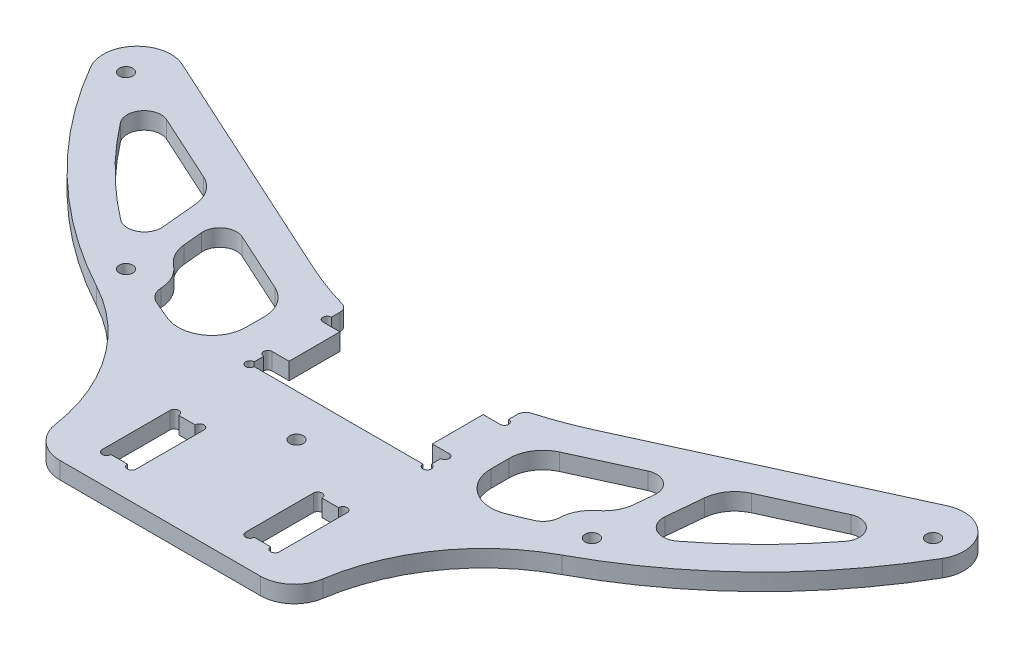
from build123d import *

# Parameters (mm, degrees)
BOSS_EXTRUDE1_DEPTH    = 6.35
FILLET4_R              = 3.175
F_10_CLEARANCE_HOLE1_D = 5.1054
CUT_EXTRUDE1_DEPTH     = 278.292988553
FILLET5_R              = 12.7
SKETCH5_R              = 1.5875
CUT_EXTRUDE2_DEPTH     = 278.292988553
CUT_EXTRUDE3_DEPTH     = 278.292988553


with BuildPart() as part:
    # Sketch1 → Boss-Extrude1 (new body)
    with BuildSketch(Plane(origin=(0, 0, 0), x_dir=(1, 0, 0), z_dir=(0, 1, 0))):
        with BuildLine():
            Line((33.17875, -158.75), (33.17875, -153.648789236))
            ThreePointArc((33.17875, -153.648789236), (34.76625, -152.061289236), (33.17875, -150.473789236))
            Line((33.17875, -150.473789236), (26.82875, -150.473789236))
            Line((26.82875, -150.473789236), (26.82875, -131.423789236))
            Line((26.82875, -131.423789236), (33.17875, -131.423789236))
            ThreePointArc((33.17875, -131.423789236), (34.76625, -129.836289236), (33.17875, -128.248789236))
            Line((33.17875, -128.248789236), (33.17875, -122.589438976))
            ThreePointArc((33.17875, -122.589438976), (43.137840894, -119.449264054), (52.805287488, -115.501522126))
            Line((52.805287488, -115.501522126), (143.19952673, -74.174847787))
            ThreePointArc((143.19952673, -74.174847787), (157.875678173, -77.180277992), (159.478578107, -92.075))
            ThreePointArc((159.478578107, -92.075), (128.201088688, -132.195700986), (87.13986874, -162.227820598))
            ThreePointArc((87.13986874, -162.227820598), (59.463291006, -188.659212722), (49.275, -225.54837334))
            Line((49.275, -225.54837334), (-49.275, -225.54837334))
            ThreePointArc((-49.275, -225.54837334), (-59.463291006, -188.659212722), (-87.13986874, -162.227820598))
            ThreePointArc((-87.13986874, -162.227820598), (-128.201088688, -132.195700986), (-159.478578107, -92.075))
            ThreePointArc((-159.478578107, -92.075), (-157.875678173, -77.180277992), (-143.19952673, -74.174847787))
            Line((-143.19952673, -74.174847787), (-52.805287488, -115.501522126))
            ThreePointArc((-52.805287488, -115.501522126), (-43.137840894, -119.449264054), (-33.17875, -122.589438976))
            Line((-33.17875, -122.589438976), (-33.17875, -128.248789236))
            ThreePointArc((-33.17875, -128.248789236), (-34.76625, -129.836289236), (-33.17875, -131.423789236))
            Line((-33.17875, -131.423789236), (-26.82875, -131.423789236))
            Line((-26.82875, -131.423789236), (-26.82875, -150.473789236))
            Line((-26.82875, -150.473789236), (-33.17875, -150.473789236))
            ThreePointArc((-33.17875, -150.473789236), (-34.76625, -152.061289236), (-33.17875, -153.648789236))
            Line((-33.17875, -153.648789236), (-33.17875, -158.75))
            Line((-33.17875, -158.75), (33.17875, -158.75))
        make_face()
    extrude(amount=BOSS_EXTRUDE1_DEPTH)

    # Fillet4
    fillet4_edges = [part.edges().sort_by_distance(p)[0] for p in [
        (33.17875, 3.175, 122.589438976),
        (-33.17875, 3.175, 122.589438976),
    ]]
    fillet(fillet4_edges, radius=FILLET4_R)

    # #10 Clearance Hole1 (through all)
    with Locations(Plane(origin=(0, 6.35, 0), x_dir=(1, 0, 0), z_dir=(0, 1, 0))):
        with Locations((-151.12143296, -87.25), (-87.25, -151.12143296), (87.25, -151.12143296), (151.12143296, -87.25), (0, -174.5)):
            Hole(F_10_CLEARANCE_HOLE1_D / 2)

    # Sketch4 → Cut-Extrude1 (cut, through all)
    with BuildSketch(Plane(origin=(0, 6.35, 0), x_dir=(1, 0, 0), z_dir=(0, 1, 0))):
        with BuildLine():
            Line((-23.754817001, -214.08399668), (-29.902682999, -214.08399668))
            ThreePointArc((-29.902682999, -214.08399668), (-31.540716499, -215.722030181), (-33.17875, -214.08399668))
            Line((-33.17875, -214.08399668), (-33.17875, -188.68399668))
            ThreePointArc((-33.17875, -188.68399668), (-31.540716499, -187.045963179), (-29.902682999, -188.68399668))
            Line((-29.902682999, -188.68399668), (-23.754817001, -188.68399668))
            ThreePointArc((-23.754817001, -188.68399668), (-22.116783501, -187.045963179), (-20.47875, -188.68399668))
            Line((-20.47875, -188.68399668), (-20.47875, -214.08399668))
            ThreePointArc((-20.47875, -214.08399668), (-22.116783501, -215.722030181), (-23.754817001, -214.08399668))
        make_face()
        with BuildLine():
            Line((23.754817001, -214.08399668), (29.902682999, -214.08399668))
            ThreePointArc((29.902682999, -214.08399668), (31.540716499, -215.722030181), (33.17875, -214.08399668))
            Line((33.17875, -214.08399668), (33.17875, -188.68399668))
            ThreePointArc((33.17875, -188.68399668), (31.540716499, -187.045963179), (29.902682999, -188.68399668))
            Line((29.902682999, -188.68399668), (23.754817001, -188.68399668))
            ThreePointArc((23.754817001, -188.68399668), (22.116783501, -187.045963179), (20.47875, -188.68399668))
            Line((20.47875, -188.68399668), (20.47875, -214.08399668))
            ThreePointArc((20.47875, -214.08399668), (22.116783501, -215.722030181), (23.754817001, -214.08399668))
        make_face()
    extrude(amount=-CUT_EXTRUDE1_DEPTH, mode=Mode.SUBTRACT)

    # Fillet5
    fillet5_edges = [part.edges().sort_by_distance(p)[0] for p in [
        (-49.275, 3.175, 225.54837334),
        (49.275, 3.175, 225.54837334),
    ]]
    fillet(fillet5_edges, radius=FILLET5_R)

    # Sketch5 → Cut-Extrude2 (cut, through all)
    with BuildSketch(Plane(origin=(0, 6.35, 0), x_dir=(1, 0, 0), z_dir=(0, 1, 0))):
        with Locations((33.17875, -158.75)):
            Circle(SKETCH5_R)
        with Locations((-33.17875, -158.75)):
            Circle(SKETCH5_R)
    extrude(amount=-CUT_EXTRUDE2_DEPTH, mode=Mode.SUBTRACT)

    # Sketch6 → Cut-Extrude3 (cut, through all)
    with BuildSketch(Plane(origin=(0, 6.35, 0), x_dir=(1, 0, 0), z_dir=(0, 1, 0))):
        with BuildLine():
            Line((-128.104892872, -95.040170045), (-102.637452085, -106.683441126))
            ThreePointArc((-102.637452085, -106.683441126), (-97.569832685, -110.871132479), (-95.274991225, -117.031589274))
            Line((-95.274991225, -117.031589274), (-93.991682853, -130.529758616))
            ThreePointArc((-93.991682853, -130.529758616), (-97.23388696, -136.684180208), (-104.171376798, -136.174251443))
            ThreePointArc((-104.171376798, -136.174251443), (-121.000806478, -121.465663179), (-135.773817141, -104.692755619))
            ThreePointArc((-135.773817141, -104.692755619), (-135.716998993, -96.865146197), (-128.104892872, -95.040170045))
        make_face()
        with BuildLine():
            Line((75.963518128, -118.878299904), (53.298221251, -129.240479515))
            ThreePointArc((53.298221251, -129.240479515), (47.89341624, -133.926693904), (45.87875, -140.790631728))
            Line((45.87875, -140.790631728), (45.87875, -147.546916431))
            ThreePointArc((45.87875, -147.546916431), (51.445237892, -158.054199858), (63.26505, -159.350669746))
            ThreePointArc((63.26505, -159.350669746), (67.071533898, -157.786285337), (70.839373095, -156.130988979))
            ThreePointArc((70.839373095, -156.130988979), (73.48252349, -153.895611155), (74.56046174, -150.606050825))
            ThreePointArc((74.56046174, -150.606050825), (75.950573651, -145.323764103), (79.430821218, -141.113913629))
            ThreePointArc((79.430821218, -141.113913629), (82.749836121, -137.208085982), (84.254632043, -132.308398362))
            Line((84.254632043, -132.308398362), (84.925277307, -125.254378043))
            ThreePointArc((84.925277307, -125.254378043), (82.285012932, -119.479301937), (75.963518128, -118.878299904))
        make_face()
        with BuildLine():
            Line((93.991682853, -130.529758616), (95.274991225, -117.031589274))
            ThreePointArc((95.274991225, -117.031589274), (97.569832685, -110.871132479), (102.637452085, -106.683441126))
            Line((102.637452085, -106.683441126), (128.104892872, -95.040170045))
            ThreePointArc((128.104892872, -95.040170045), (135.716998993, -96.865146197), (135.773817141, -104.692755619))
            ThreePointArc((135.773817141, -104.692755619), (121.000806478, -121.465663179), (104.171376798, -136.174251443))
            ThreePointArc((104.171376798, -136.174251443), (97.23388696, -136.684180208), (93.991682853, -130.529758616))
        make_face()
        with BuildLine():
            Line((-45.87875, -140.790631728), (-45.87875, -147.546916431))
            ThreePointArc((-45.87875, -147.546916431), (-51.445237892, -158.054199858), (-63.26505, -159.350669746))
            ThreePointArc((-63.26505, -159.350669746), (-67.071533898, -157.786285337), (-70.839373095, -156.130988979))
            ThreePointArc((-70.839373095, -156.130988979), (-73.48252349, -153.895611155), (-74.56046174, -150.606050825))
            ThreePointArc((-74.56046174, -150.606050825), (-75.950573651, -145.323764103), (-79.430821218, -141.113913629))
            ThreePointArc((-79.430821218, -141.113913629), (-82.749836121, -137.208085982), (-84.254632043, -132.308398362))
            Line((-84.254632043, -132.308398362), (-84.925277307, -125.254378043))
            ThreePointArc((-84.925277307, -125.254378043), (-82.285012932, -119.479301937), (-75.963518128, -118.878299904))
            Line((-75.963518128, -118.878299904), (-53.298221251, -129.240479515))
            ThreePointArc((-53.298221251, -129.240479515), (-47.89341624, -133.926693904), (-45.87875, -140.790631728))
        make_face()
    extrude(amount=-CUT_EXTRUDE3_DEPTH, mode=Mode.SUBTRACT)


solid = part.part
